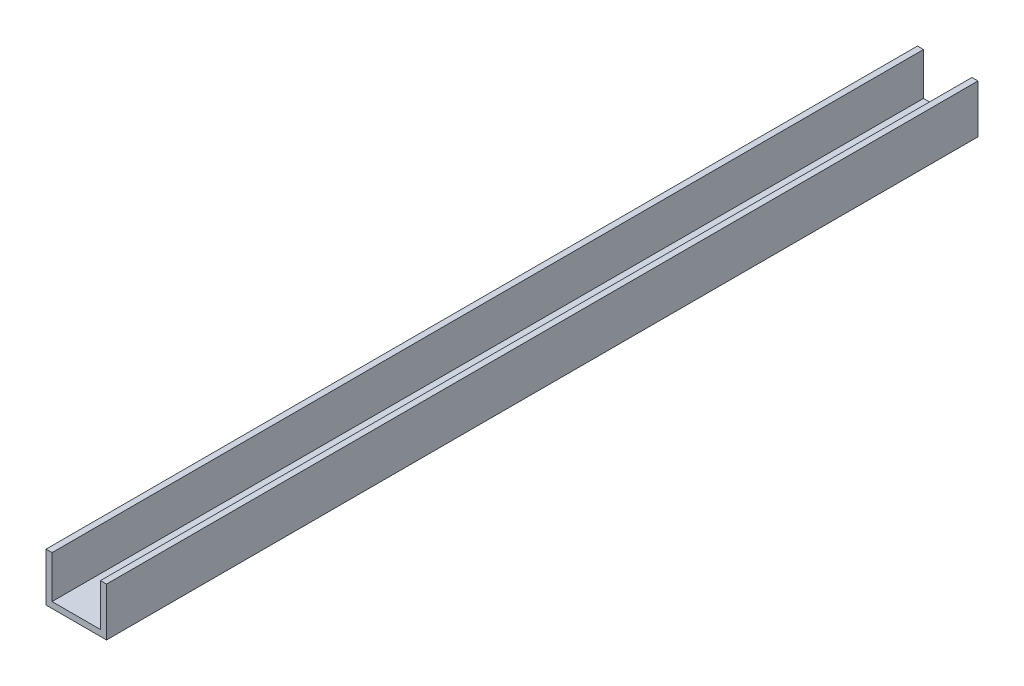
from build123d import *

# Parameters (mm, degrees)
BOSS_EXTRUDE2_DEPTH  = 609.6
CUT_EXTRUDE1_DEPTH   = 1016
M6_CLEARANCE_HOLE1_D = 6.4
BOSS_EXTRUDE3_DEPTH  = 254


with BuildPart() as part:
    # Sketch3 → Boss-Extrude2 (new, symmetric)
    with BuildSketch(Plane.XY):
        Polygon((-15.875, 12.7), (-15.875, -12.7), (15.875, -12.7), (15.875, 12.7), (12.7, 12.7), (12.7, -9.525), (-12.7, -9.525), (-12.7, 12.7), align=None)
    extrude(amount=BOSS_EXTRUDE2_DEPTH, both=True)

    # Sketch5 → Cut-Extrude1 (cut)
    with BuildSketch(Plane.XY.offset(609.6)):
        Polygon((-15.875, 12.7), (-12.7, 12.7), (-12.7, -9.525), (12.7, -9.525), (12.7, 12.7), (15.875, 12.7), (15.875, -12.7), (-15.875, -12.7), align=None)
    extrude(amount=-CUT_EXTRUDE1_DEPTH, mode=Mode.SUBTRACT)

    # M6 Clearance Hole1 (through all)
    with Locations(Plane(origin=(0, -9.525, 0), x_dir=(1, 0, 0), z_dir=(0, 1, 0))):
        with Locations((0, 594.6)):
            Hole(M6_CLEARANCE_HOLE1_D / 2)

    # Sketch8 → Boss-Extrude3 (add)
    with BuildSketch(Plane(origin=(0, 0, -609.6), x_dir=(-1, 0, 0), z_dir=(0, 0, -1))):
        Polygon((-15.875, 12.7), (-12.7, 12.7), (-12.7, -9.525), (12.7, -9.525), (12.7, 12.7), (15.875, 12.7), (15.875, -12.7), (-15.875, -12.7), align=None)
    extrude(amount=BOSS_EXTRUDE3_DEPTH)


solid = part.part
